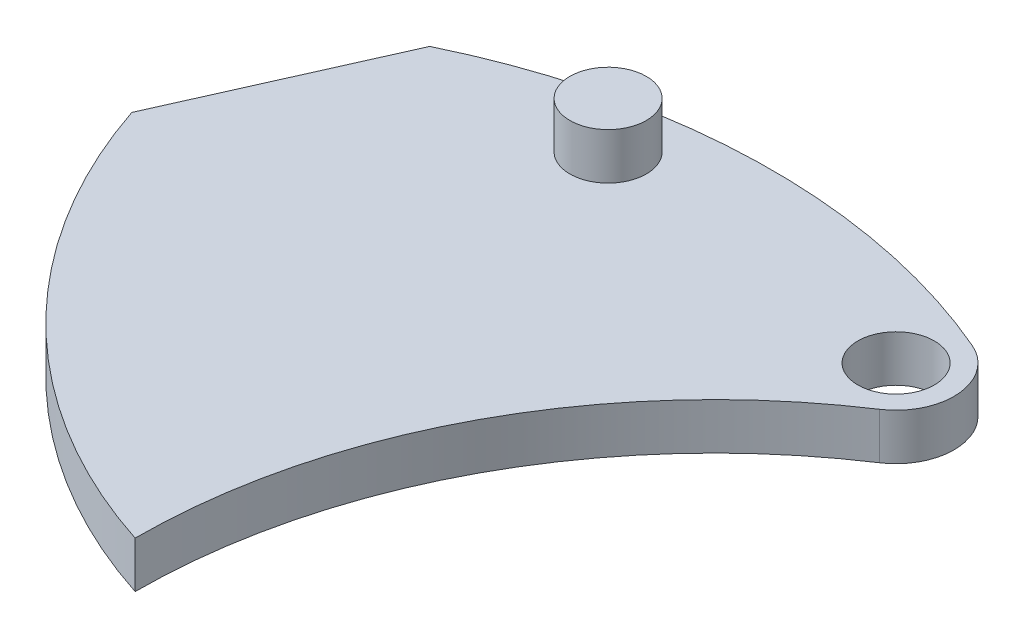
from build123d import *

# Parameters (mm, degrees)
BOSS_EXTRUDE1_DEPTH = 2
FILLET1_R           = 2.5
SKETCH2_R           = 1.65
CUT_EXTRUDE1_DEPTH  = 2
CUT_EXTRUDE2_REACH  = 34.399
SKETCH6_R           = 1.65
BOSS_EXTRUDE2_DEPTH = 4


with BuildPart() as part:
    # Sketch1 → Boss-Extrude1 (new body)
    with BuildSketch(Plane(origin=(0, 0, 0), x_dir=(1, 0, 0), z_dir=(0, 1, 0))):
        with BuildLine():
            ThreePointArc((15.125, 22.967027997), (-1.263298306, 27.470967901), (-17.169059596, 21.48193177))
            ThreePointArc((-17.169059596, 21.48193177), (-11.803604023, 8.168176911), (0, 0))
            ThreePointArc((0, 0), (4.120883639, 13.75), (15.125, 22.967027997))
        make_face()
    extrude(amount=BOSS_EXTRUDE1_DEPTH)

    # Fillet1
    fillet1_edges = [part.edges().sort_by_distance(p)[0] for p in [
        (-17.169059596, 1, -21.48193177),
        (15.125, 1, -22.967027997),
    ]]
    fillet(fillet1_edges, radius=FILLET1_R)

    # Sketch2 → Cut-Extrude1 (cut)
    with BuildSketch(Plane(origin=(0, 2, 0), x_dir=(1, 0, 0), z_dir=(0, 1, 0))):
        with Locations(Location((-4.226868107, 24.640080885, 0), (0, 0, 270))):
            Circle(SKETCH2_R)
        with Locations(Location((9.875, 22.967027997, 0), (0, 0, 270))):
            Circle(SKETCH2_R)
    extrude(amount=-CUT_EXTRUDE1_DEPTH, mode=Mode.SUBTRACT)

    # Sketch3 → Cut-Extrude2 (cut, up to next)
    with BuildSketch(Plane(origin=(0, 2, 0), x_dir=(1, 0, 0), z_dir=(0, 1, 0)), mode=Mode.PRIVATE) as cut_extrude2_sk1:
        with BuildLine():
            Line((-15.980917027, 15.838569726), (-12.020745702, 24.733614228))
            ThreePointArc((-12.020745702, 24.733614228), (-14.04148027, 23.645017061), (-15.964394934, 22.391696997))
            ThreePointArc((-15.964394934, 22.391696997), (-16.816313344, 21.328273965), (-16.984031989, 19.976052098))
            ThreePointArc((-16.984031989, 19.976052098), (-16.570708205, 17.885919028), (-15.980917027, 15.838569726))
        make_face()
    cut_extrude2_tool1 = extrude(cut_extrude2_sk1.sketch, amount=-CUT_EXTRUDE2_REACH, mode=Mode.PRIVATE) & part.part
    add(cut_extrude2_tool1.solids().sort_by_distance((-15.061244, 2, -20.693622))[0], mode=Mode.SUBTRACT)


with BuildPart() as body_2:
    # Sketch6 → Boss-Extrude2 (new body)
    with BuildSketch(Plane.XZ):
        with Locations(Location((-4.226868107, -24.640080885, 0), (0, 0, 270))):
            Circle(SKETCH6_R)
    extrude(amount=-BOSS_EXTRUDE2_DEPTH)


solid = Compound([part.part, body_2.part])
